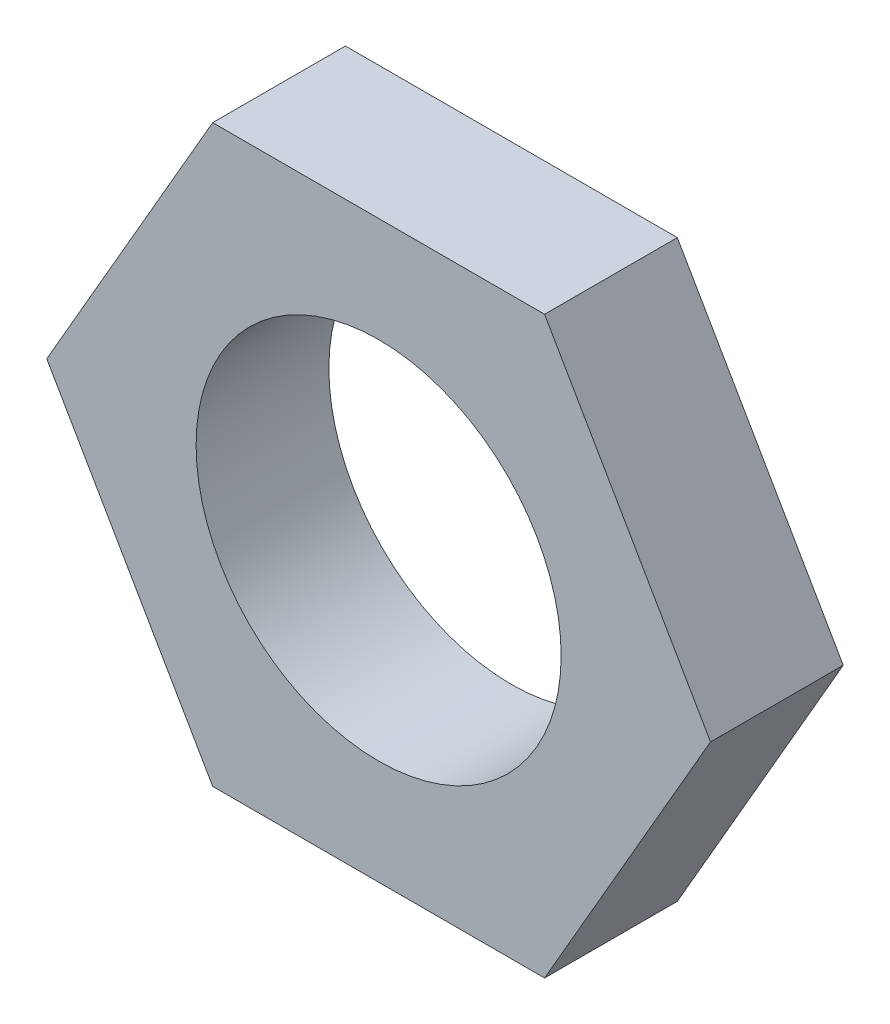
from build123d import *

# Parameters (mm, degrees)
BOSS_EXTRUDE1_DEPTH = 2
SKETCH3_R           = 2.75
CUT_EXTRUDE1_DEPTH  = 7.910137481


with BuildPart() as part:
    # Sketch1 → Boss-Extrude1 (new body)
    with BuildSketch(Plane.XY):
        Polygon((-2.5, -4.330127019), (2.5, -4.330127019), (5, 0), (2.5, 4.330127019), (-2.5, 4.330127019), (-5, 0), align=None)
    extrude(amount=BOSS_EXTRUDE1_DEPTH)

    # Sketch3 → Cut-Extrude1 (cut, through all)
    with BuildSketch(Plane(origin=(0, 0, 0), x_dir=(-1, 0, 0), z_dir=(0, 0, -1))):
        Circle(SKETCH3_R)
    extrude(amount=-CUT_EXTRUDE1_DEPTH, mode=Mode.SUBTRACT)


solid = part.part
